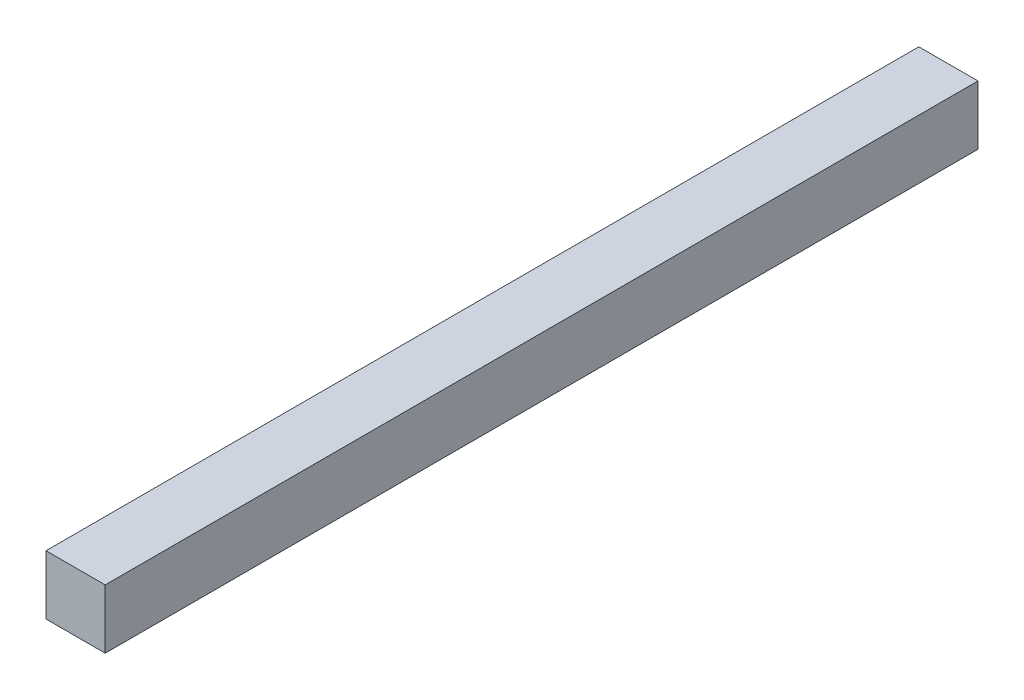
from build123d import *

# Parameters (mm, degrees)
ESQUISSE1_W        = 10
ESQUISSE1_H        = 10
BOSS_EXTRU_1_DEPTH = 147.5


with BuildPart() as part:
    # Esquisse1 → Boss.-Extru.1 (new body)
    with BuildSketch(Plane.XY):
        with Locations((-45, -5)):
            Rectangle(ESQUISSE1_W, ESQUISSE1_H)
    extrude(amount=BOSS_EXTRU_1_DEPTH)


solid = part.part
